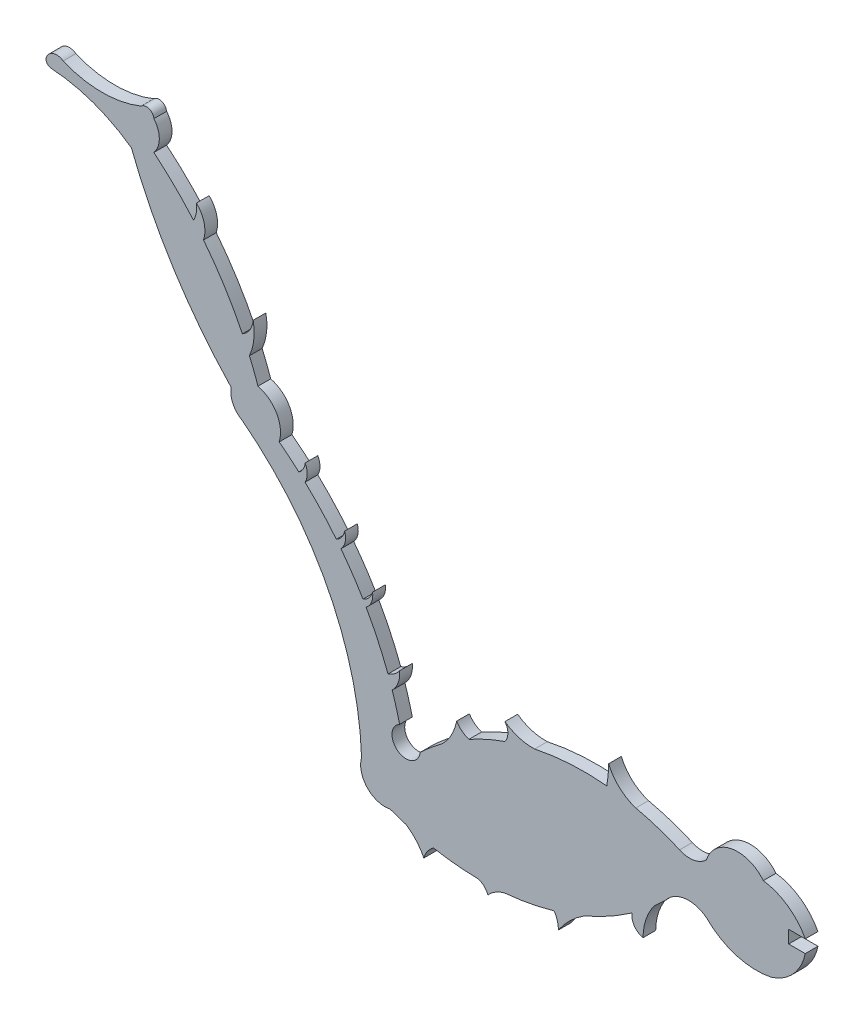
from build123d import *

# Parameters (mm, degrees)
BOSS_EXTRUDE1_DEPTH = 1.524


with BuildPart() as part:
    # Sketch1 → Boss-Extrude1 (new body)
    with BuildSketch(Plane.XY):
        with BuildLine():
            Line((-80.678958716, -0.762), (-80.678958716, -1.524))
            Line((-80.678958716, -1.524), (-78.692395213, -1.524))
            ThreePointArc((-78.692395213, -1.524), (-80.119170164, -4.335621645), (-82.784103237, -6.02056519))
            ThreePointArc((-82.784103237, -6.02056519), (-86.955126255, -5.857190971), (-90.544084344, -3.725641304))
            ThreePointArc((-90.544084344, -3.725641304), (-93.110836317, -3.021062409), (-95.425262377, -4.335626641))
            ThreePointArc((-95.425262377, -4.335626641), (-96.090143572, -4.970756046), (-96.773276943, -5.586211293))
            ThreePointArc((-96.773276943, -5.586211293), (-97.784617842, -7.488047423), (-98.148581764, -9.611092724))
            ThreePointArc((-98.148581764, -9.611092724), (-99.181314776, -8.914327019), (-99.479737369, -7.704796582))
            ThreePointArc((-99.479737369, -7.704796582), (-102.262807493, -9.439979809), (-105.21119287, -10.876421181))
            ThreePointArc((-105.21119287, -10.876421181), (-106.91403356, -12.226062588), (-108.305450104, -13.894941956))
            ThreePointArc((-108.305450104, -13.894941956), (-108.413080528, -12.98188304), (-108.807060537, -12.151196188))
            ThreePointArc((-108.807060537, -12.151196188), (-111.729155507, -12.842858899), (-114.703828793, -13.253169951))
            ThreePointArc((-114.703828793, -13.253169951), (-115.819933123, -13.705232404), (-116.747990814, -14.472538249))
            ThreePointArc((-116.747990814, -14.472538249), (-117.190021542, -13.789583851), (-117.891000612, -13.376732524))
            ThreePointArc((-117.891000612, -13.376732524), (-120.590758029, -13.228581749), (-123.267868738, -12.849481471))
            ThreePointArc((-123.267868738, -12.849481471), (-123.990419129, -13.559319569), (-124.428575307, -14.472538249))
            ThreePointArc((-124.428575307, -14.472538249), (-125.32839078, -13.121289449), (-126.552690184, -12.05515992))
            ThreePointArc((-126.552690184, -12.05515992), (-127.525021572, -11.746786856), (-128.486859712, -11.407096306))
            ThreePointArc((-128.486859712, -11.407096306), (-131.218641373, -10.554840596), (-131.89233577, -7.773634616))
            ThreePointArc((-131.89233577, -7.773634616), (-135.917529766, 7.745683618), (-146.180659468, 20.063134404))
            ThreePointArc((-146.180659468, 20.063134404), (-147.307798591, 21.249069948), (-147.538428831, 22.868852467))
            ThreePointArc((-147.538428831, 22.868852467), (-154.433810452, 31.715414423), (-159.483026723, 41.731070227))
            ThreePointArc((-159.483026723, 41.731070227), (-164.057778752, 44.14499505), (-169.123893732, 45.188962572))
            ThreePointArc((-169.123893732, 45.188962572), (-169.613633215, 45.467140142), (-169.695148012, 46.024439755))
            ThreePointArc((-169.695148012, 46.024439755), (-168.84624225, 46.858034119), (-167.67211669, 46.665811009))
            ThreePointArc((-167.67211669, 46.665811009), (-162.988364111, 45.736856959), (-158.304611532, 46.665811009))
            ThreePointArc((-158.304611532, 46.665811009), (-157.376988383, 46.865370886), (-156.791979775, 46.118327526))
            ThreePointArc((-156.791979775, 46.118327526), (-156.141187023, 44.363429515), (-156.791979775, 42.608531504))
            ThreePointArc((-156.791979775, 42.608531504), (-154.321595691, 40.375345287), (-152.040654012, 37.948985202))
            ThreePointArc((-152.040654012, 37.948985202), (-151.707852276, 38.902874077), (-151.688853759, 39.9129731))
            ThreePointArc((-151.688853759, 39.9129731), (-150.771869741, 38.327385628), (-150.840091724, 36.497005044))
            ThreePointArc((-150.840091724, 36.497005044), (-148.311639905, 32.912883943), (-146.180659468, 29.07909795))
            ThreePointArc((-146.180659468, 29.07909795), (-145.280256751, 29.950524174), (-144.888474533, 31.140740714))
            ThreePointArc((-144.888474533, 31.140740714), (-144.809080792, 29.152180218), (-145.336243225, 27.233124206))
            ThreePointArc((-145.336243225, 27.233124206), (-144.799576526, 25.915962426), (-144.308931698, 24.580974055))
            ThreePointArc((-144.308931698, 24.580974055), (-142.066206257, 22.868864738), (-141.767740402, 20.063146675))
            ThreePointArc((-141.767740402, 20.063146675), (-140.574422381, 19.11655359), (-139.418496756, 18.124645168))
            ThreePointArc((-139.418496756, 18.124645168), (-138.882087848, 18.686270696), (-138.666940721, 19.432507564))
            ThreePointArc((-138.666940721, 19.432507564), (-138.402251182, 18.434511119), (-138.666940721, 17.436514673))
            ThreePointArc((-138.666940721, 17.436514673), (-136.72060571, 15.475055994), (-134.91620317, 13.382289501))
            ThreePointArc((-134.91620317, 13.382289501), (-134.269462496, 13.942240539), (-133.926062208, 14.725754998))
            ThreePointArc((-133.926062208, 14.725754998), (-133.856105481, 13.639249521), (-134.361203786, 12.674747683))
            ThreePointArc((-134.361203786, 12.674747683), (-132.981359798, 10.757644416), (-131.718603375, 8.761472935))
            ThreePointArc((-131.718603375, 8.761472935), (-130.994013595, 9.278385285), (-130.576166715, 10.064281405))
            ThreePointArc((-130.576166715, 10.064281405), (-130.688633828, 8.984081435), (-131.3478244, 8.120977377))
            ThreePointArc((-131.3478244, 8.120977377), (-129.923570985, 5.358468693), (-128.720985312, 2.492506426))
            ThreePointArc((-128.720985312, 2.492506426), (-127.945801885, 2.902637911), (-127.329634113, 3.526700773))
            ThreePointArc((-127.329634113, 3.526700773), (-127.497659552, 2.19677598), (-128.218534166, 1.066611259))
            ThreePointArc((-128.218534166, 1.066611259), (-127.742305365, -0.477350315), (-127.329634113, -2.039500643))
            ThreePointArc((-127.329634113, -2.039500643), (-127.508941307, -4.933154821), (-124.873174428, -3.725629032))
            ThreePointArc((-124.873174428, -3.725629032), (-123.596637716, -2.585576016), (-122.254131396, -1.524))
            ThreePointArc((-122.254131396, -1.524), (-121.118350406, -0.039599921), (-120.48608758, 1.71928773))
            ThreePointArc((-120.48608758, 1.71928773), (-119.861122825, 1.004984574), (-119.026219436, 0.55360195))
            ThreePointArc((-119.026219436, 0.55360195), (-116.905277713, 1.612791346), (-114.703828793, 2.492506426))
            ThreePointArc((-114.703828793, 2.492506426), (-114.347417181, 3.526700773), (-114.703828793, 4.560895121))
            ThreePointArc((-114.703828793, 4.560895121), (-113.011657325, 3.726445198), (-111.139333293, 3.493735784))
            ThreePointArc((-111.139333293, 3.493735784), (-106.83626692, 4.069231273), (-102.495682566, 3.986148614))
            ThreePointArc((-102.495682566, 3.986148614), (-102.332792834, 5.191235076), (-102.264713723, 6.405373321))
            ThreePointArc((-102.264713723, 6.405373321), (-100.962727059, 4.560895121), (-99.006554721, 3.433660057))
            ThreePointArc((-99.006554721, 3.433660057), (-96.34050231, 2.703577616), (-93.757475163, 1.71928773))
            ThreePointArc((-93.757475163, 1.71928773), (-92.060227448, 1.486006715), (-90.544083581, 2.283739511))
            ThreePointArc((-90.544083581, 2.283739511), (-87.507868111, 4.942615236), (-83.724934757, 3.536329442))
            ThreePointArc((-83.724934757, 3.536329442), (-80.783552437, 2.373141079), (-78.692395213, 0))
            Line((-78.692395213, 0), (-80.678958716, 0))
            Line((-80.678958716, 0), (-80.678958716, -0.762))
        make_face()
    extrude(amount=BOSS_EXTRUDE1_DEPTH)


solid = part.part
